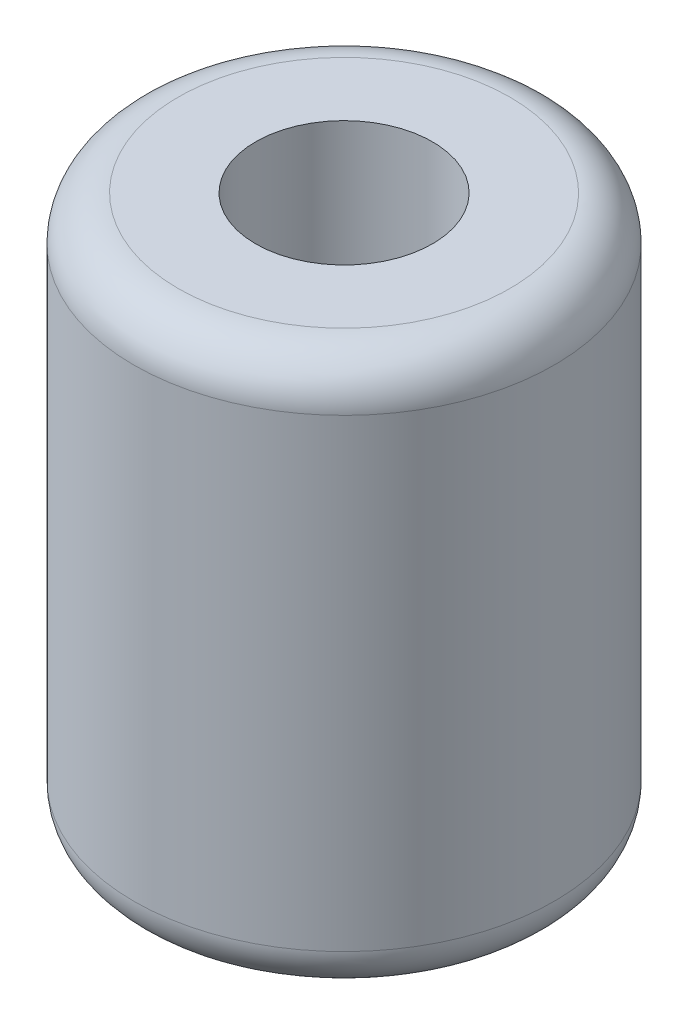
from build123d import *

# Parameters (mm, degrees)
SKETCH_1_R          = 9.5
EXTRUDE_1_DEPTH     = 25
FILLET_1_R          = 2
HOLE_WIZARD_1_D     = 8
HOLE_WIZARD_1_DEPTH = 12.5
HOLE_WIZARD_2_D     = 5


with BuildPart() as part:
    # 草图1 → 凸台-拉伸1 (new body)
    with BuildSketch(Plane(origin=(0, 0, 0), x_dir=(1, 0, 0), z_dir=(0, 1, 0))):
        Circle(SKETCH_1_R)
    extrude(amount=EXTRUDE_1_DEPTH)

    # 圆角1
    fillet_1_edges = [part.edges().sort_by_distance(p)[0] for p in [
        (-9.5, 0, 0),
        (-9.5, 25, 0),
    ]]
    fillet(fillet_1_edges, radius=FILLET_1_R)

    # 孔1
    with Locations(Plane(origin=(0, 25, 0), x_dir=(1, 0, 0), z_dir=(0, 1, 0))):
        with Locations((0, 0)):
            Hole(HOLE_WIZARD_1_D / 2, depth=HOLE_WIZARD_1_DEPTH)

    # 孔2 (through all)
    with Locations(Plane(origin=(0, 0, 0), x_dir=(-1, 0, 0), z_dir=(0, -1, 0))):
        with Locations((0, 0)):
            Hole(HOLE_WIZARD_2_D / 2)


solid = part.part
